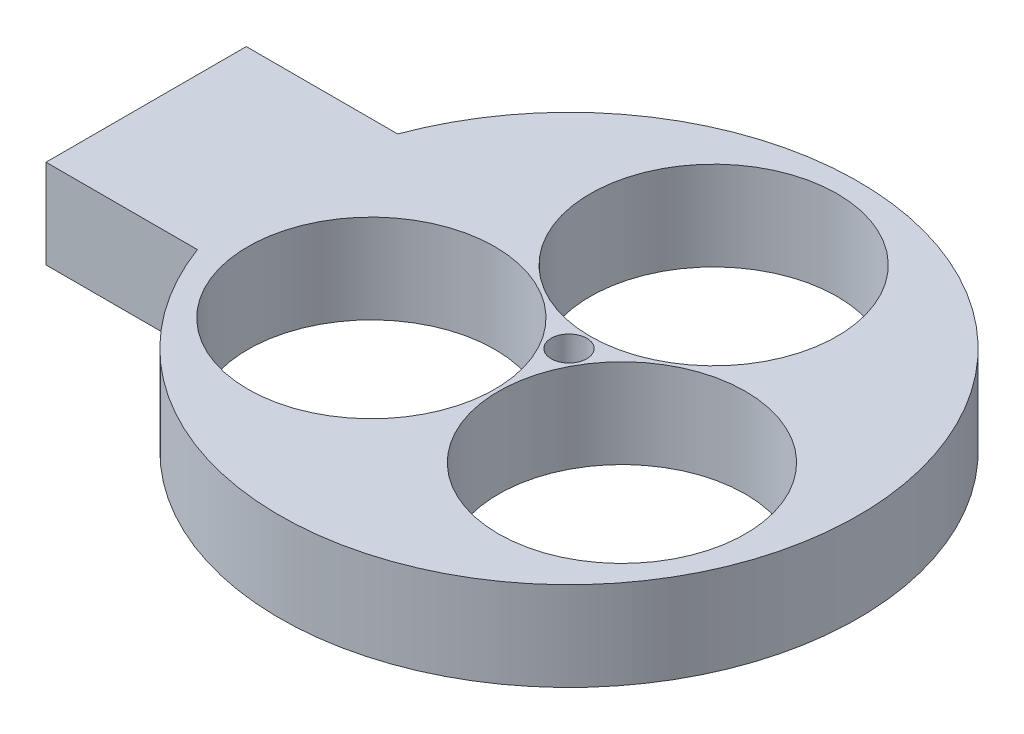
from build123d import *

# Parameters (mm, degrees)
SKETCH1_R           = 13.000723037
SKETCH1_R_2         = 5.55
SKETCH1_R_3         = 0.8
PLACA_CABEZAL_DEPTH = 4
SKETCH2_W           = 7.5
SKETCH2_H           = 9
PATA_AL_HUESO_DEPTH = 4


with BuildPart() as part:
    # Sketch1 → Placa_cabezal (new body)
    with BuildSketch(Plane(origin=(0, -2, 0), x_dir=(1, 0, 0), z_dir=(0, 1, 0))):
        with Locations(Location((0, 0, 0), (0, 0, 270))):
            Circle(SKETCH1_R)
        with Locations(Location((0, 6.5, 0), (0, 0, 270))):
            Circle(SKETCH1_R_2, mode=Mode.SUBTRACT)
        with Locations(Location((-5.63, -3.25, 0), (0, 0, 270))):
            Circle(SKETCH1_R_2, mode=Mode.SUBTRACT)
        with Locations(Location((5.63, -3.25, 0), (0, 0, 270))):
            Circle(SKETCH1_R_2, mode=Mode.SUBTRACT)
        with Locations(Location((0, 0, 0), (0, 0, 270))):
            Circle(SKETCH1_R_3, mode=Mode.SUBTRACT)
    extrude(amount=PLACA_CABEZAL_DEPTH)

    # Sketch2 → Pata_al_hueso (add)
    with BuildSketch(Plane(origin=(0, -2, 0), x_dir=(1, 0, 0), z_dir=(0, 1, 0))):
        with Locations((-15.250723037, 0)):
            Rectangle(SKETCH2_W, SKETCH2_H)
    extrude(amount=PATA_AL_HUESO_DEPTH)


solid = part.part
